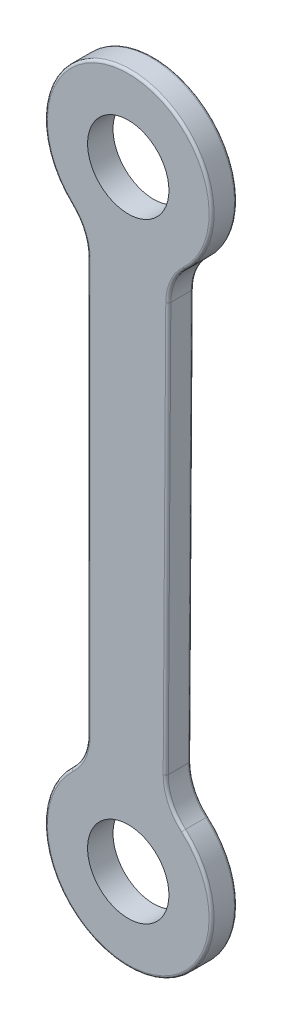
from build123d import *

# Parameters (mm, degrees)
SKETCH_1_R      = 8
EXTRUDE_1_DEPTH = 5
FILLET_1_R      = 0.5


with BuildPart() as part:
    # 草图1 → 凸台-拉伸1 (new body)
    with BuildSketch(Plane.XY):
        with BuildLine():
            Line((-8, 19.305502441), (-8, 100.694497559))
            ThreePointArc((-8, 100.694497559), (-8.829546885, 104.682327755), (-11.180557935, 108.008539527))
            ThreePointArc((-11.180557935, 108.008539527), (0.051988176, 136.395038799), (11.104284737, 107.93787496))
            ThreePointArc((11.104284737, 107.93787496), (8.732226543, 104.626639898), (7.877406014, 100.644150781))
            Line((7.877406014, 100.644150781), (7.365590706, 19.941690023))
            ThreePointArc((7.365590706, 19.941690023), (8.247647691, 15.771352421), (10.786374698, 12.347231304))
            ThreePointArc((10.786374698, 12.347231304), (0.265496379, -16.392971411), (-11.180557935, 11.991460473))
            ThreePointArc((-11.180557935, 11.991460473), (-8.829546885, 15.317672245), (-8, 19.305502441))
        make_face()
        with Locations((0, 120)):
            Circle(SKETCH_1_R, mode=Mode.SUBTRACT)
        Circle(SKETCH_1_R, mode=Mode.SUBTRACT)
    extrude(amount=EXTRUDE_1_DEPTH)

    # 圆角1
    fillet_1_edges = [part.edges().sort_by_distance(p)[0] for p in [
        (0.265496379, -16.392971411, 0),
        (-8.829546885, 15.317672245, 0),
        (-8, 60, 0),
        (-8.829546885, 104.682327755, 0),
        (-8.829546885, 15.317672245, 5),
        (0.265496379, -16.392971411, 5),
        (8.247647691, 15.771352421, 5),
        (7.62149836, 60.292920402, 5),
        (8.732226543, 104.626639898, 5),
        (0.051988176, 136.395038799, 5),
        (-8.829546885, 104.682327755, 5),
        (0.051988176, 136.395038799, 0),
        (-8, 60, 5),
        (8.732226543, 104.626639898, 0),
        (7.62149836, 60.292920402, 0),
        (8.247647691, 15.771352421, 0),
    ]]
    fillet(fillet_1_edges, radius=FILLET_1_R)


solid = part.part
